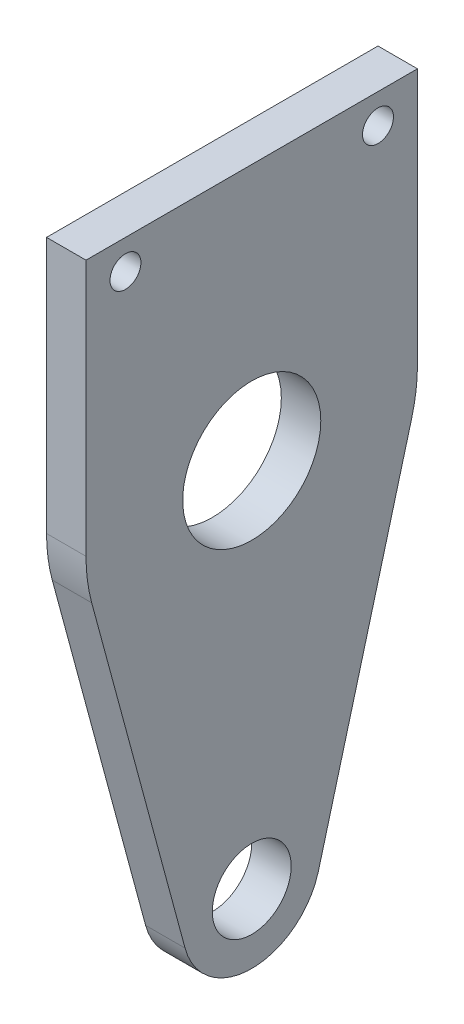
from build123d import *

# Parameters (mm, degrees)
SKETCH1_R              = 6.35
SKETCH1_R_2            = 11.1125
BOSS_EXTRUDE1_DEPTH    = 6.35
F_10_CLEARANCE_HOLE1_D = 4.9784


with BuildPart() as part:
    # Sketch1 → Boss-Extrude1 (new body)
    with BuildSketch(Plane(origin=(0, 0, 0), x_dir=(0, 0, -1), z_dir=(1, 0, 0))):
        with BuildLine():
            Line((-25.748192037, 52.738776596), (-10.728413349, -2.896343085))
            ThreePointArc((-10.728413349, -2.896343085), (0, -11.1125), (10.728413349, -2.896343085))
            Line((10.728413349, -2.896343085), (25.748192037, 52.738776596))
            ThreePointArc((25.748192037, 52.738776596), (26.438543659, 56.183961041), (26.67, 59.69))
            Line((26.67, 59.69), (26.67, 100.96397257))
            Line((26.67, 100.96397257), (-26.67, 100.96397257))
            Line((-26.67, 100.96397257), (-26.67, 59.69))
            ThreePointArc((-26.67, 59.69), (-26.438543659, 56.183961041), (-25.748192037, 52.738776596))
        make_face()
        Circle(SKETCH1_R, mode=Mode.SUBTRACT)
        with Locations((0, 59.69)):
            Circle(SKETCH1_R_2, mode=Mode.SUBTRACT)
    extrude(amount=BOSS_EXTRUDE1_DEPTH)

    # #10 Clearance Hole1 (through all)
    with Locations(Plane.ZY):
        with Locations((20.32, 96.20147257), (-20.32, 96.20147257)):
            Hole(F_10_CLEARANCE_HOLE1_D / 2)


solid = part.part
